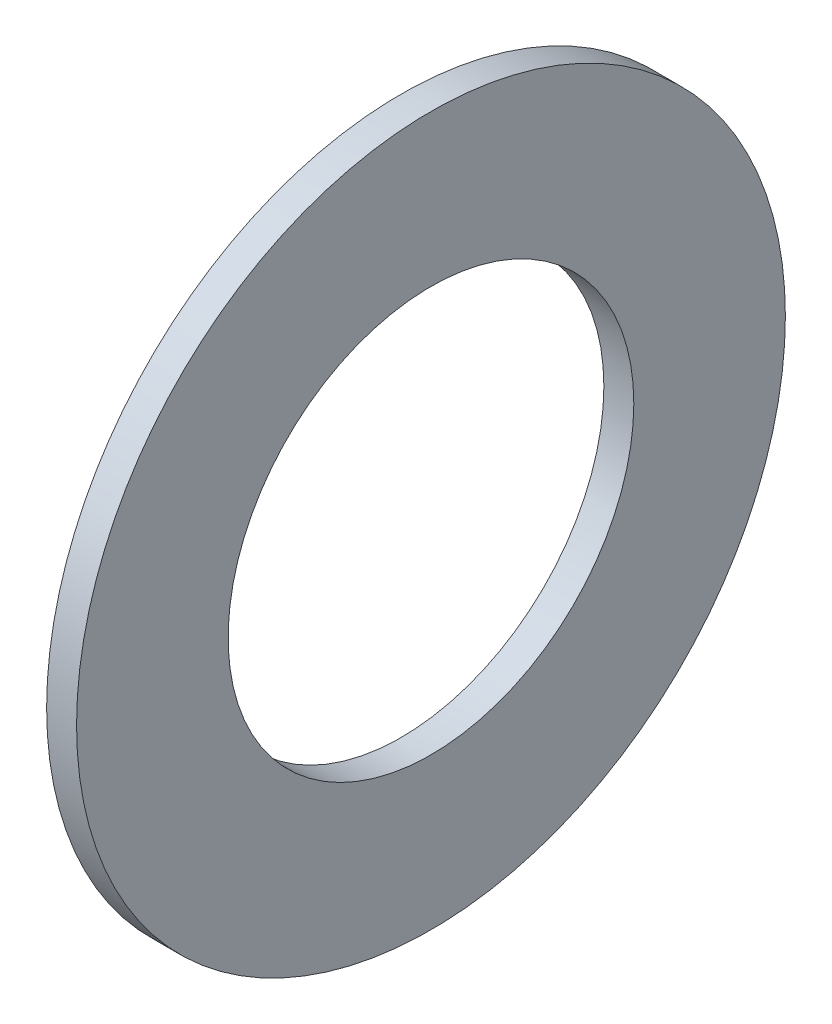
from build123d import *

# Parameters (mm, degrees)
SKETCH1_R           = 47.35
SKETCH1_R_2         = 27.1
BOSS_EXTRUDE1_DEPTH = 4


with BuildPart() as part:
    # Sketch1 → Boss-Extrude1 (new body)
    with BuildSketch(Plane(origin=(0, 0, 0), x_dir=(0, 0, -1), z_dir=(1, 0, 0))):
        Circle(SKETCH1_R)
        Circle(SKETCH1_R_2, mode=Mode.SUBTRACT)
    extrude(amount=BOSS_EXTRUDE1_DEPTH)


solid = part.part
